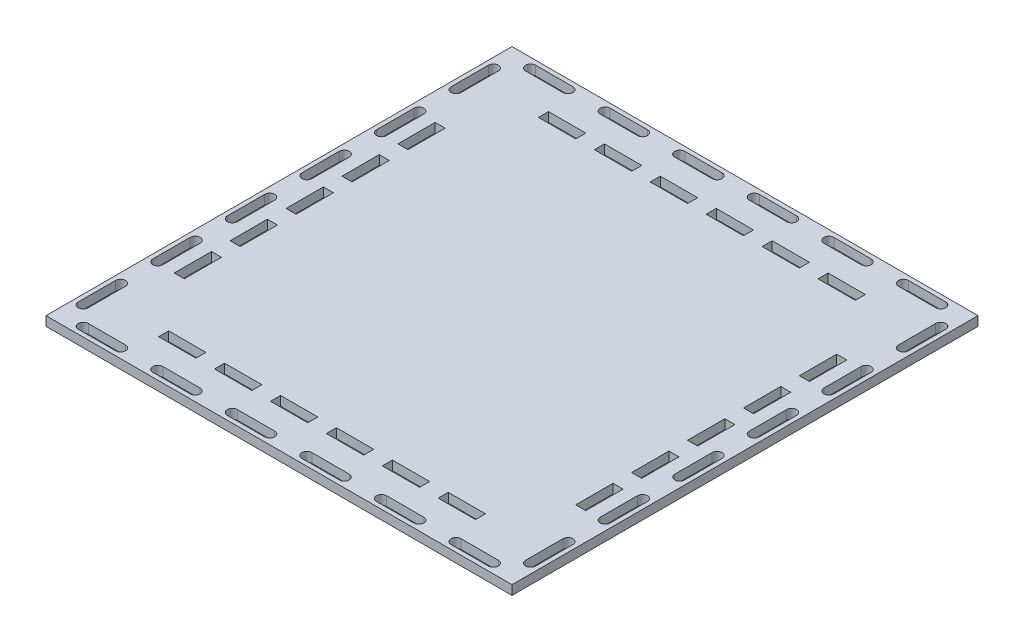
from build123d import *

# Parameters (mm, degrees)
SKETCH1_W           = 317.5
SKETCH1_H           = 317.5
BOSS_EXTRUDE1_DEPTH = 6.35
SKETCH2_W           = 25.4
SKETCH2_H           = 6.858
SKETCH2_W_2         = 6.858
SKETCH2_H_2         = 25.4
CUT_EXTRUDE2_DEPTH  = 225.596187635


with BuildPart() as part:
    # Sketch1 → Boss-Extrude1 (new body)
    with BuildSketch(Plane(origin=(0, 0, 0), x_dir=(1, 0, 0), z_dir=(0, 1, 0))):
        Rectangle(SKETCH1_W, SKETCH1_H)
    extrude(amount=BOSS_EXTRUDE1_DEPTH)

    # Sketch2 → Cut-Extrude2 (cut, through all)
    with BuildSketch(Plane(origin=(0, 0, 0), x_dir=(1, 0, 0), z_dir=(0, 1, 0))):
        with Locations((-95.25, 129.39049275)):
            Rectangle(SKETCH2_W, SKETCH2_H)
        with Locations((-57.15, 129.39049275)):
            Rectangle(SKETCH2_W, SKETCH2_H)
        with Locations((-19.05, 129.39049275)):
            Rectangle(SKETCH2_W, SKETCH2_H)
        with Locations((19.05, 129.39049275)):
            Rectangle(SKETCH2_W, SKETCH2_H)
        with Locations((57.15, 129.39049275)):
            Rectangle(SKETCH2_W, SKETCH2_H)
        with Locations((95.25, 129.39049275)):
            Rectangle(SKETCH2_W, SKETCH2_H)
        with Locations((-136.779, 37.06149275)):
            Rectangle(SKETCH2_W_2, SKETCH2_H_2)
        with Locations((-136.779, 75.16149275)):
            Rectangle(SKETCH2_W_2, SKETCH2_H_2)
        with Locations((-136.779, -1.03850725)):
            Rectangle(SKETCH2_W_2, SKETCH2_H_2)
        with Locations((-136.779, -39.13850725)):
            Rectangle(SKETCH2_W_2, SKETCH2_H_2)
        with Locations((-136.779, -77.23850725)):
            Rectangle(SKETCH2_W_2, SKETCH2_H_2)
        with Locations((136.779, -77.23850725)):
            Rectangle(SKETCH2_W_2, SKETCH2_H_2)
        with Locations((136.779, -39.13850725)):
            Rectangle(SKETCH2_W_2, SKETCH2_H_2)
        with Locations((136.779, -1.03850725)):
            Rectangle(SKETCH2_W_2, SKETCH2_H_2)
        with Locations((136.779, 37.06149275)):
            Rectangle(SKETCH2_W_2, SKETCH2_H_2)
        with Locations((136.779, 75.16149275)):
            Rectangle(SKETCH2_W_2, SKETCH2_H_2)
        with BuildLine():
            Line((-139.7, 155.829), (-114.3, 155.829))
            ThreePointArc((-114.3, 155.829), (-110.871, 152.4), (-114.3, 148.971))
            Line((-114.3, 148.971), (-139.7, 148.971))
            ThreePointArc((-139.7, 148.971), (-143.129, 152.4), (-139.7, 155.829))
        make_face()
        with Locations((95.25, -129.39049275)):
            Rectangle(SKETCH2_W, SKETCH2_H)
        with Locations((57.15, -129.39049275)):
            Rectangle(SKETCH2_W, SKETCH2_H)
        with Locations((19.05, -129.39049275)):
            Rectangle(SKETCH2_W, SKETCH2_H)
        with Locations((-19.05, -129.39049275)):
            Rectangle(SKETCH2_W, SKETCH2_H)
        with Locations((-57.15, -129.39049275)):
            Rectangle(SKETCH2_W, SKETCH2_H)
        with Locations((-95.25, -129.39049275)):
            Rectangle(SKETCH2_W, SKETCH2_H)
        with BuildLine():
            Line((-88.9, 155.829), (-63.5, 155.829))
            ThreePointArc((-63.5, 155.829), (-60.071, 152.4), (-63.5, 148.971))
            Line((-63.5, 148.971), (-88.9, 148.971))
            ThreePointArc((-88.9, 148.971), (-92.329, 152.4), (-88.9, 155.829))
        make_face()
        with BuildLine():
            Line((-155.829, 139.7), (-155.829, 114.3))
            ThreePointArc((-155.829, 114.3), (-152.4, 110.871), (-148.971, 114.3))
            Line((-148.971, 114.3), (-148.971, 139.7))
            ThreePointArc((-148.971, 139.7), (-152.4, 143.129), (-155.829, 139.7))
        make_face()
        with BuildLine():
            Line((-148.971, 63.5), (-148.971, 88.9))
            ThreePointArc((-148.971, 88.9), (-152.4, 92.329), (-155.829, 88.9))
            Line((-155.829, 88.9), (-155.829, 63.5))
            ThreePointArc((-155.829, 63.5), (-152.4, 60.071), (-148.971, 63.5))
        make_face()
        with BuildLine():
            Line((-148.971, 12.7), (-148.971, 38.1))
            ThreePointArc((-148.971, 38.1), (-152.4, 41.529), (-155.829, 38.1))
            Line((-155.829, 38.1), (-155.829, 12.7))
            ThreePointArc((-155.829, 12.7), (-152.4, 9.271), (-148.971, 12.7))
        make_face()
        with BuildLine():
            Line((-148.971, -38.1), (-148.971, -12.7))
            ThreePointArc((-148.971, -12.7), (-152.4, -9.271), (-155.829, -12.7))
            Line((-155.829, -12.7), (-155.829, -38.1))
            ThreePointArc((-155.829, -38.1), (-152.4, -41.529), (-148.971, -38.1))
        make_face()
        with BuildLine():
            Line((-148.971, -88.9), (-148.971, -63.5))
            ThreePointArc((-148.971, -63.5), (-152.4, -60.071), (-155.829, -63.5))
            Line((-155.829, -63.5), (-155.829, -88.9))
            ThreePointArc((-155.829, -88.9), (-152.4, -92.329), (-148.971, -88.9))
        make_face()
        with BuildLine():
            Line((-148.971, -139.7), (-148.971, -114.3))
            ThreePointArc((-148.971, -114.3), (-152.4, -110.871), (-155.829, -114.3))
            Line((-155.829, -114.3), (-155.829, -139.7))
            ThreePointArc((-155.829, -139.7), (-152.4, -143.129), (-148.971, -139.7))
        make_face()
        with BuildLine():
            Line((-38.1, 155.829), (-12.7, 155.829))
            ThreePointArc((-12.7, 155.829), (-9.271, 152.4), (-12.7, 148.971))
            Line((-12.7, 148.971), (-38.1, 148.971))
            ThreePointArc((-38.1, 148.971), (-41.529, 152.4), (-38.1, 155.829))
        make_face()
        with BuildLine():
            Line((12.7, 155.829), (38.1, 155.829))
            ThreePointArc((38.1, 155.829), (41.529, 152.4), (38.1, 148.971))
            Line((38.1, 148.971), (12.7, 148.971))
            ThreePointArc((12.7, 148.971), (9.271, 152.4), (12.7, 155.829))
        make_face()
        with BuildLine():
            Line((63.5, 155.829), (88.9, 155.829))
            ThreePointArc((88.9, 155.829), (92.329, 152.4), (88.9, 148.971))
            Line((88.9, 148.971), (63.5, 148.971))
            ThreePointArc((63.5, 148.971), (60.071, 152.4), (63.5, 155.829))
        make_face()
        with BuildLine():
            Line((114.3, 155.829), (139.7, 155.829))
            ThreePointArc((139.7, 155.829), (143.129, 152.4), (139.7, 148.971))
            Line((139.7, 148.971), (114.3, 148.971))
            ThreePointArc((114.3, 148.971), (110.871, 152.4), (114.3, 155.829))
        make_face()
        with BuildLine():
            Line((139.7, -148.971), (114.3, -148.971))
            ThreePointArc((114.3, -148.971), (110.871, -152.4), (114.3, -155.829))
            Line((114.3, -155.829), (139.7, -155.829))
            ThreePointArc((139.7, -155.829), (143.129, -152.4), (139.7, -148.971))
        make_face()
        with BuildLine():
            Line((88.9, -148.971), (63.5, -148.971))
            ThreePointArc((63.5, -148.971), (60.071, -152.4), (63.5, -155.829))
            Line((63.5, -155.829), (88.9, -155.829))
            ThreePointArc((88.9, -155.829), (92.329, -152.4), (88.9, -148.971))
        make_face()
        with BuildLine():
            Line((38.1, -148.971), (12.7, -148.971))
            ThreePointArc((12.7, -148.971), (9.271, -152.4), (12.7, -155.829))
            Line((12.7, -155.829), (38.1, -155.829))
            ThreePointArc((38.1, -155.829), (41.529, -152.4), (38.1, -148.971))
        make_face()
        with BuildLine():
            Line((-12.7, -148.971), (-38.1, -148.971))
            ThreePointArc((-38.1, -148.971), (-41.529, -152.4), (-38.1, -155.829))
            Line((-38.1, -155.829), (-12.7, -155.829))
            ThreePointArc((-12.7, -155.829), (-9.271, -152.4), (-12.7, -148.971))
        make_face()
        with BuildLine():
            Line((-63.5, -148.971), (-88.9, -148.971))
            ThreePointArc((-88.9, -148.971), (-92.329, -152.4), (-88.9, -155.829))
            Line((-88.9, -155.829), (-63.5, -155.829))
            ThreePointArc((-63.5, -155.829), (-60.071, -152.4), (-63.5, -148.971))
        make_face()
        with BuildLine():
            Line((-114.3, -148.971), (-139.7, -148.971))
            ThreePointArc((-139.7, -148.971), (-143.129, -152.4), (-139.7, -155.829))
            Line((-139.7, -155.829), (-114.3, -155.829))
            ThreePointArc((-114.3, -155.829), (-110.871, -152.4), (-114.3, -148.971))
        make_face()
        with BuildLine():
            Line((155.829, -114.3), (155.829, -139.7))
            ThreePointArc((155.829, -139.7), (152.4, -143.129), (148.971, -139.7))
            Line((148.971, -139.7), (148.971, -114.3))
            ThreePointArc((148.971, -114.3), (152.4, -110.871), (155.829, -114.3))
        make_face()
        with BuildLine():
            Line((155.829, -63.5), (155.829, -88.9))
            ThreePointArc((155.829, -88.9), (152.4, -92.329), (148.971, -88.9))
            Line((148.971, -88.9), (148.971, -63.5))
            ThreePointArc((148.971, -63.5), (152.4, -60.071), (155.829, -63.5))
        make_face()
        with BuildLine():
            Line((155.829, -12.7), (155.829, -38.1))
            ThreePointArc((155.829, -38.1), (152.4, -41.529), (148.971, -38.1))
            Line((148.971, -38.1), (148.971, -12.7))
            ThreePointArc((148.971, -12.7), (152.4, -9.271), (155.829, -12.7))
        make_face()
        with BuildLine():
            Line((155.829, 38.1), (155.829, 12.7))
            ThreePointArc((155.829, 12.7), (152.4, 9.271), (148.971, 12.7))
            Line((148.971, 12.7), (148.971, 38.1))
            ThreePointArc((148.971, 38.1), (152.4, 41.529), (155.829, 38.1))
        make_face()
        with BuildLine():
            Line((155.829, 88.9), (155.829, 63.5))
            ThreePointArc((155.829, 63.5), (152.4, 60.071), (148.971, 63.5))
            Line((148.971, 63.5), (148.971, 88.9))
            ThreePointArc((148.971, 88.9), (152.4, 92.329), (155.829, 88.9))
        make_face()
        with BuildLine():
            Line((148.971, 114.3), (148.971, 139.7))
            ThreePointArc((148.971, 139.7), (152.4, 143.129), (155.829, 139.7))
            Line((155.829, 139.7), (155.829, 114.3))
            ThreePointArc((155.829, 114.3), (152.4, 110.871), (148.971, 114.3))
        make_face()
    extrude(amount=CUT_EXTRUDE2_DEPTH, mode=Mode.SUBTRACT)


solid = part.part
